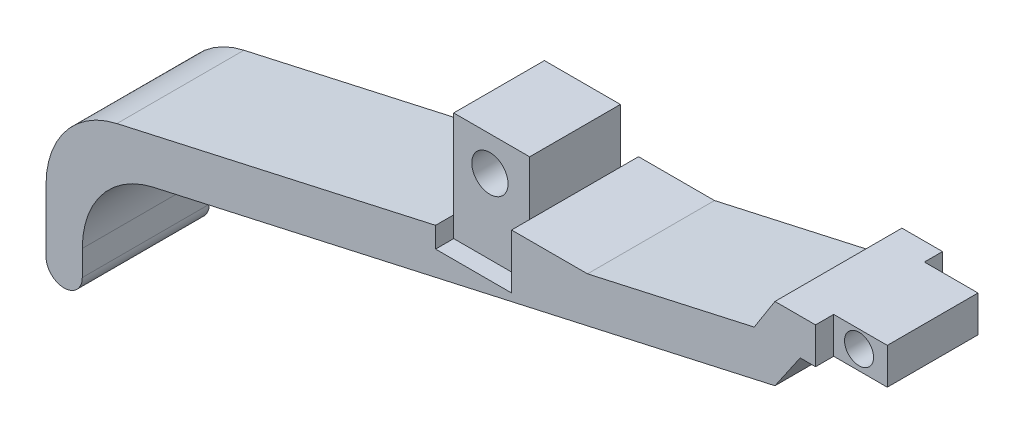
from build123d import *

# Parameters (mm, degrees)
BOSS_EXTRUDE2_DEPTH = 7
BOSS_EXTRUDE3_DEPTH = 7
SKETCH3_R           = 1
CUT_EXTRUDE1_DEPTH  = 7
SKETCH4_R           = 0.8
CUT_EXTRUDE2_DEPTH  = 7
SKETCH6_W           = 2.954985002
SKETCH6_H           = 1
CUT_EXTRUDE3_DEPTH  = 10
SKETCH7_W           = 4.187886823
SKETCH7_H           = 1
CUT_EXTRUDE5_DEPTH  = 6


with BuildPart() as part:
    # Sketch1 → Boss-Extrude2 (new body)
    with BuildSketch(Plane.XY):
        with BuildLine():
            Line((3.153391707, 12.247099593), (4.296460399, 14.043350396))
            Line((4.296460399, 14.043350396), (9.489380334, 14.043350396))
            Line((9.489380334, 14.043350396), (9.489380334, 12.043350396))
            Line((9.489380334, 12.043350396), (5.687282028, 12.043350396))
            Line((5.687282028, 12.043350396), (4.296460399, 10.01751105))
            Line((4.296460399, 10.01751105), (-29.974468214, 2.361481073))
            ThreePointArc((-29.974468214, 2.361481073), (-32.786312372, 0.608216504), (-33.884352793, -2.51823699))
            Line((-33.884352793, -2.51823699), (-33.884352793, -3.909471954))
            ThreePointArc((-33.884352793, -3.909471954), (-34.884352793, -4.909471954), (-35.884352793, -3.909471954))
            Line((-35.884352793, -3.909471954), (-35.884352793, -0.480084513))
            ThreePointArc((-35.884352793, -0.480084513), (-34.786312372, 2.646368981), (-31.974468214, 4.399633549))
            Line((-31.974468214, 4.399633549), (3.153391707, 12.247099593))
        make_face()
    extrude(amount=BOSS_EXTRUDE2_DEPTH)

    # Sketch2 → Boss-Extrude3 (add)
    with BuildSketch(Plane.XY.offset(7)):
        Polygon((-6.034764609, 10.194491069), (-10.222651431, 10.194491069), (-10.222651431, 13.1883213), (-14.410538254, 13.1883213), (-14.410538254, 10.194491069), (-14.410538254, 8.323366571), align=None)
    extrude(amount=-BOSS_EXTRUDE3_DEPTH)

    # Sketch3 → Cut-Extrude1 (cut)
    with BuildSketch(Plane.XY.offset(7)):
        with Locations((-12.414768406, 11.299883581)):
            Circle(SKETCH3_R)
    extrude(amount=-CUT_EXTRUDE1_DEPTH, mode=Mode.SUBTRACT)

    # Sketch4 → Cut-Extrude2 (cut)
    with BuildSketch(Plane.XY.offset(7)):
        with Locations((7.932339973, 13.090243395)):
            Circle(SKETCH4_R)
    extrude(amount=-CUT_EXTRUDE2_DEPTH, mode=Mode.SUBTRACT)

    # Sketch6 → Cut-Extrude3 (cut)
    with BuildSketch(Plane.XZ.offset(-12.043350396)):
        with Locations((8.011887833, 6.5)):
            Rectangle(SKETCH6_W, SKETCH6_H)
        with Locations((8.011887833, 0.5)):
            Rectangle(SKETCH6_W, SKETCH6_H)
    extrude(amount=-CUT_EXTRUDE3_DEPTH, mode=Mode.SUBTRACT)

    # Sketch7 → Cut-Extrude5 (cut)
    with BuildSketch(Plane(origin=(0, 13.1883213, 0), x_dir=(1, 0, 0), z_dir=(0, 1, 0))):
        with Locations((-12.316594843, -0.5)):
            Rectangle(SKETCH7_W, SKETCH7_H)
        with Locations((-12.316594843, -6.5)):
            Rectangle(SKETCH7_W, SKETCH7_H)
    extrude(amount=-CUT_EXTRUDE5_DEPTH, mode=Mode.SUBTRACT)


solid = part.part
